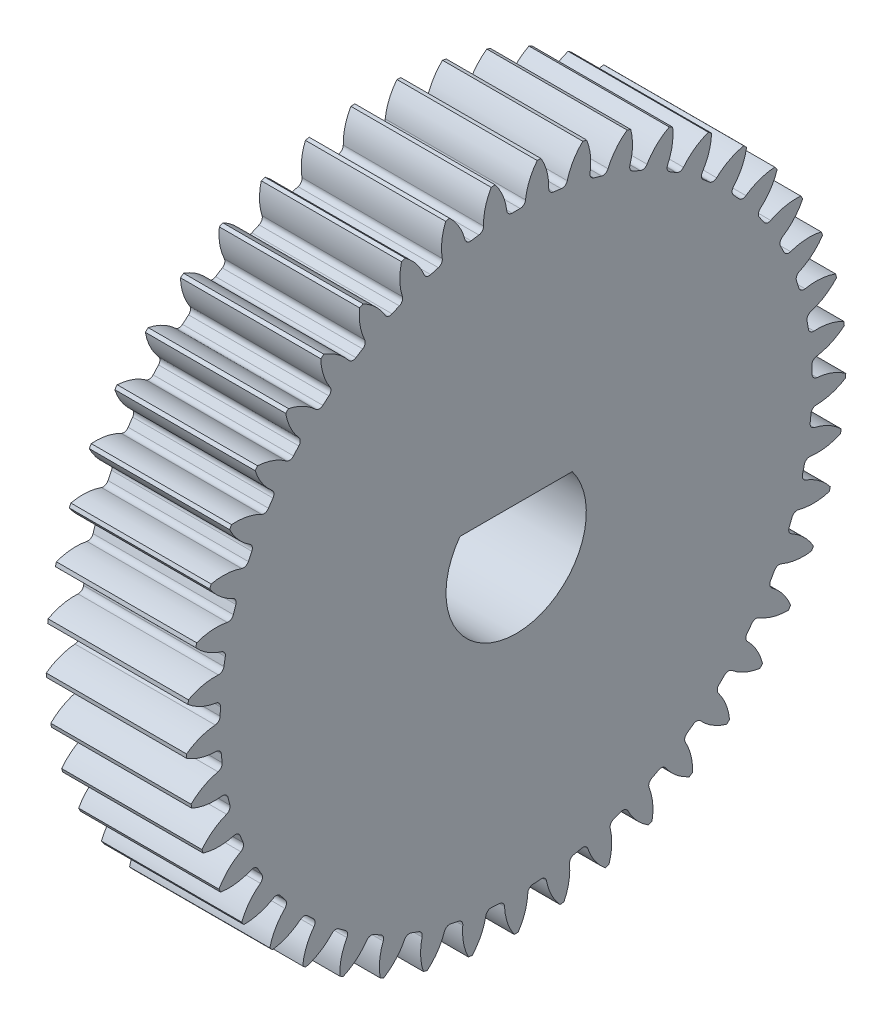
from build123d import *

# Parameters (mm, degrees)
SKETCH1_R                = 23.5
SKETCH1_R_2              = 5
BOSS_EXTRUDE2_DEPTH      = 10
CUT_EXTRUDE1_DEPTH       = 35.705907278
FILLET1_R                = 0.38
CIRPATTERN2_COUNT        = 45
FILLET1_OF_CIRPATTERN2_R = 0.38
BOSS_EXTRUDE3_START      = -10
BOSS_EXTRUDE3_DEPTH      = 10


with BuildPart() as part:
    # Sketch1 → Boss-Extrude2 (new body)
    with BuildSketch(Plane(origin=(0, 0, 0), x_dir=(0, 0, -1), z_dir=(1, 0, 0))):
        Circle(SKETCH1_R)
        Circle(SKETCH1_R_2, mode=Mode.SUBTRACT)
    extrude(amount=BOSS_EXTRUDE2_DEPTH)

    # Sketch3 → Cut-Extrude1 (cut, through all)
    with BuildSketch(Plane(origin=(10, 0, 0), x_dir=(0, 0, -1), z_dir=(1, 0, 0))):
        with BuildLine():
            ThreePointArc((0.641274584, 21.090252889), (0, 21.1), (-0.641274584, 21.090252889))
            ThreePointArc((-0.641274584, 21.090252889), (-0.881317151, 22.340205971), (-1.500888231, 23.452021971))
            ThreePointArc((-1.500888231, 23.452021971), (0, 23.5), (1.500888231, 23.452021971))
            ThreePointArc((1.500888231, 23.452021971), (0.881317151, 22.340205971), (0.641274584, 21.090252889))
        make_face()
    cut_extrude1 = extrude(amount=-CUT_EXTRUDE1_DEPTH, mode=Mode.SUBTRACT)

    # Fillet1
    fillet1_edges = [part.edges().sort_by_distance(p)[0] for p in [
        (5, 21.090252889, 0.641274584),
        (5, 21.090252889, -0.641274584),
    ]]
    fillet(fillet1_edges, radius=FILLET1_R)

    # CirPattern2: Cut-Extrude1 ×45 about axis
    cirpattern2_axis = Axis((0, 0, 0), (1, 0, 0))
    for i in range(1, CIRPATTERN2_COUNT):
        add(cut_extrude1.rotate(cirpattern2_axis, i * 360 / CIRPATTERN2_COUNT), mode=Mode.SUBTRACT)

    # Fillet1 of CirPattern2
    fillet1_of_cirpattern2_edges = [part.edges().sort_by_distance(p)[0] for p in [
        (5, 20.795755825, 3.570229639),
        (5, 20.97425217, 2.30016215),
        (5, 20.096493029, 6.429694234),
        (5, 20.45001149, 5.196828845),
        (5, 19.006074855, 9.164012145),
        (5, 19.527734599, 7.992345178),
        (5, 17.545725054, 11.719962984),
        (5, 18.225372566, 10.632299603),
        (5, 15.743867672, 14.047798074),
        (5, 16.568274387, 13.06530841),
        (5, 13.635573815, 16.102208754),
        (5, 14.588693593, 15.244015851),
        (5, 11.261879023, 17.843208256),
        (5, 12.325160473, 17.126015863),
        (5, 8.668984566, 19.236910006),
        (5, 9.821732123, 18.674677456),
        (5, 5.907358186, 20.256187185),
        (5, 7.12713493, 19.859857695),
        (5, 3.030751798, 20.881200721),
        (5, 4.293816163, 20.658488395),
        (5, 0.095155274, 21.099785437),
        (5, 1.376923148, 21.055025116),
        (5, -2.84229334, 20.90768683),
        (5, -1.566770109, 21.041749723),
        (5, -5.724419946, 20.308643881),
        (5, -4.479967969, 20.618920607),
        (5, -8.49512723, 19.31431628),
        (5, -7.305968348, 19.794767655),
        (5, -11.100486525, 17.944057482),
        (5, -9.989766363, 18.585332066),
        (5, -13.489787477, 16.224538016),
        (5, -12.47912494, 17.014154129),
        (5, -15.61652506, 14.189226373),
        (5, -14.725591544, 15.111815036),
        (5, -17.439304746, 11.877737578),
        (5, -16.685441259, 12.915341652),
        (5, -18.922648202, 9.335062133),
        (5, -18.32052784, 10.467485834),
        (5, -20.037683835, 6.610690321),
        (5, -19.599026185, 7.815892311),
        (5, -20.762708745, 3.757648942),
        (5, -20.496051779, 5.012171334),
        (5, -21.083611146, 0.8314692),
        (5, -20.994145039, 2.110894144),
        (5, -20.994145039, -2.110894144),
        (5, -21.083611146, -0.8314692),
        (5, -20.496051779, -5.012171334),
        (5, -20.762708745, -3.757648942),
        (5, -19.599026185, -7.815892311),
        (5, -20.037683835, -6.610690321),
        (5, -18.32052784, -10.467485834),
        (5, -18.922648202, -9.335062133),
        (5, -16.685441259, -12.915341652),
        (5, -17.439304746, -11.877737578),
        (5, -14.725591544, -15.111815036),
        (5, -15.61652506, -14.189226373),
        (5, -12.47912494, -17.014154129),
        (5, -13.489787477, -16.224538016),
        (5, -9.989766363, -18.585332066),
        (5, -11.100486525, -17.944057482),
        (5, -7.305968348, -19.794767655),
        (5, -8.49512723, -19.31431628),
        (5, -4.479967969, -20.618920607),
        (5, -5.724419946, -20.308643881),
        (5, -1.566770109, -21.041749723),
        (5, -2.84229334, -20.90768683),
        (5, 1.376923148, -21.055025116),
        (5, 0.095155274, -21.099785437),
        (5, 4.293816163, -20.658488395),
        (5, 3.030751798, -20.881200721),
        (5, 7.12713493, -19.859857695),
        (5, 5.907358186, -20.256187185),
        (5, 9.821732123, -18.674677456),
        (5, 8.668984566, -19.236910006),
        (5, 12.325160473, -17.126015863),
        (5, 11.261879023, -17.843208256),
        (5, 14.588693593, -15.244015851),
        (5, 13.635573815, -16.102208754),
        (5, 16.568274387, -13.06530841),
        (5, 15.743867672, -14.047798074),
        (5, 18.225372566, -10.632299603),
        (5, 17.545725054, -11.719962984),
        (5, 19.527734599, -7.992345178),
        (5, 19.006074855, -9.164012145),
        (5, 20.45001149, -5.196828845),
        (5, 20.096493029, -6.429694234),
        (5, 20.97425217, -2.30016215),
        (5, 20.795755825, -3.570229639),
    ]]
    fillet(fillet1_of_cirpattern2_edges, radius=FILLET1_OF_CIRPATTERN2_R)

    # Sketch4 → Boss-Extrude3 (add)
    with BuildSketch(Plane(origin=(10, 0, 0), x_dir=(0, 0, -1), z_dir=(1, 0, 0)).offset(BOSS_EXTRUDE3_START)):
        with BuildLine():
            Line((-4, 3), (4, 3))
            ThreePointArc((4, 3), (0, 5), (-4, 3))
        make_face()
    extrude(amount=BOSS_EXTRUDE3_DEPTH)


solid = part.part
